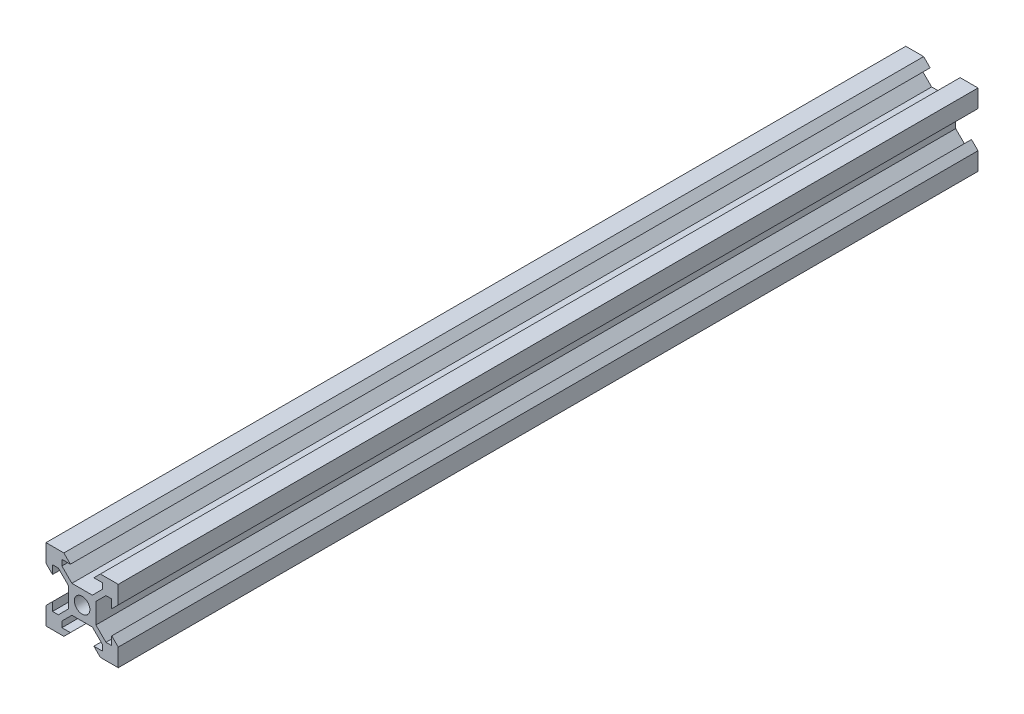
from build123d import *

# Parameters (mm, degrees)
CROQUIS1_R              = 2.15
SALIENTE_EXTRUIR2_DEPTH = 238


with BuildPart() as part:
    # Croquis1 → Saliente-Extruir2 (new body)
    with BuildSketch(Plane.XY):
        Polygon((4.4, 0), (0, 0), (0, -0.56736664), (0, -4.4), (0, -4.95), (1.8, -6.75), (1.8, -4.4), (3.410050506, -4.4), (6.175, -7.164949494), (6.175, -12.835050506), (3.410050506, -15.6), (1.8, -15.6), (1.8, -13.25), (0, -15.05), (0, -15.6), (0, -20), (4.4, -20), (4.95, -20), (6.75, -18.2), (4.4, -18.2), (4.4, -16.589949494), (7.164949494, -13.825), (12.835050506, -13.825), (15.6, -16.589949494), (15.6, -18.2), (13.25, -18.2), (15.05, -20), (15.6, -20), (18.2, -20), (20, -20), (20, -15.6), (20, -15.05), (18.2, -13.25), (18.2, -15.6), (16.589949494, -15.6), (13.825, -12.835050506), (13.825, -7.164949494), (16.589949494, -4.4), (18.2, -4.4), (18.2, -6.75), (20, -4.95), (20, -4.4), (20, 0), (15.6, 0), (15.05, 0), (13.25, -1.8), (15.6, -1.8), (15.6, -3.410050506), (12.835050506, -6.175), (7.164949494, -6.175), (4.4, -3.410050506), (4.4, -1.8), (6.75, -1.8), (4.95, 0), align=None)
        with Locations((10, -10)):
            Circle(CROQUIS1_R, mode=Mode.SUBTRACT)
    extrude(amount=SALIENTE_EXTRUIR2_DEPTH)


solid = part.part
